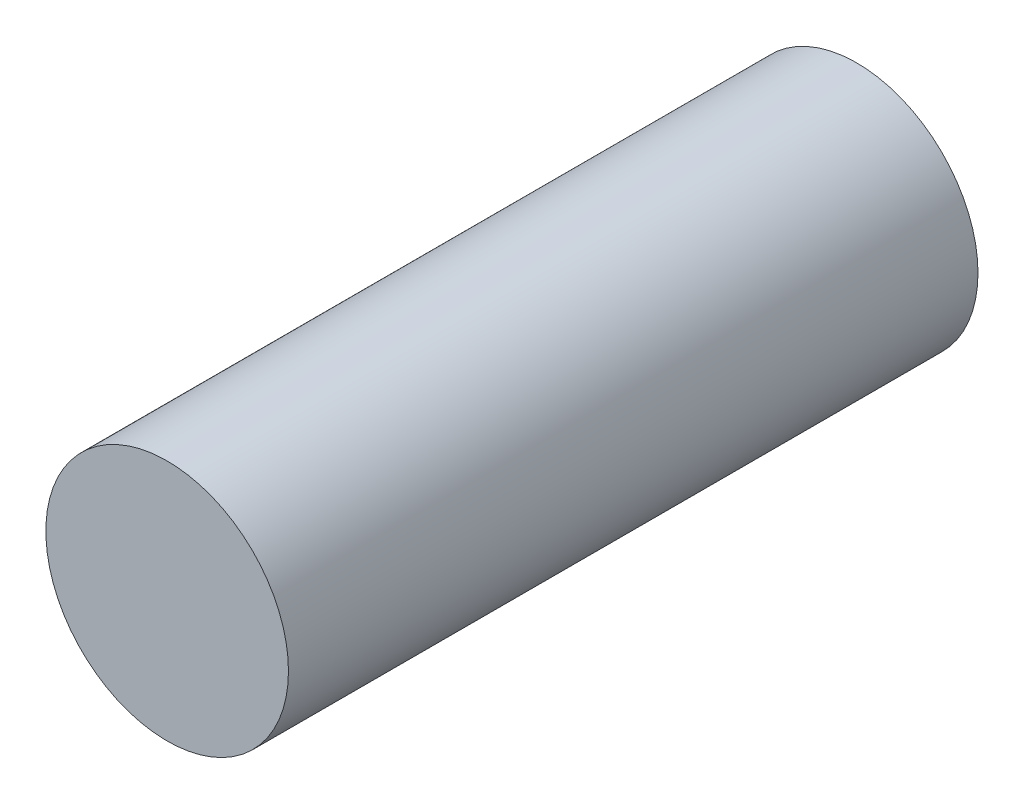
from build123d import *

# Parameters (mm, degrees)
SKETCH_1_R      = 9.5
EXTRUDE_1_DEPTH = 54


with BuildPart() as part:
    # Эскиз1 → Бобышка-Вытянуть1 (new body)
    with BuildSketch(Plane.XY):
        Circle(SKETCH_1_R)
    extrude(amount=EXTRUDE_1_DEPTH)


solid = part.part
